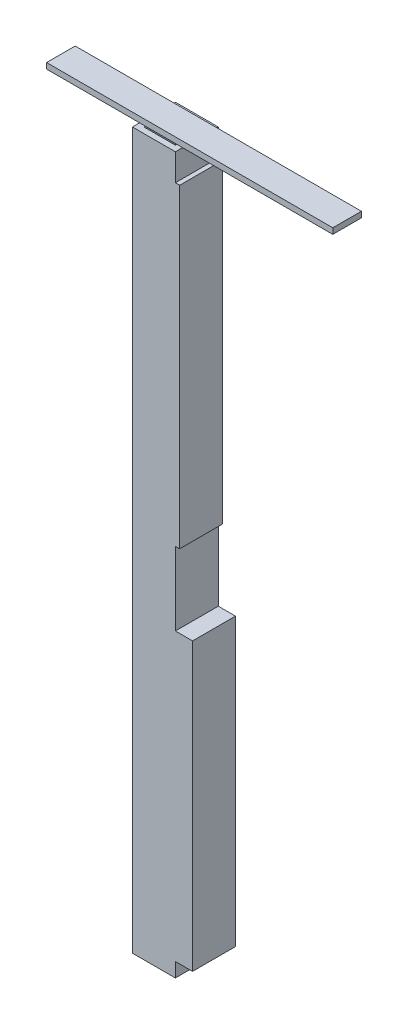
from build123d import *

# Parameters (mm, degrees)
SKETCH1_W          = 30
SKETCH1_H          = 30
EXTRUDE1_DEPTH     = 500
SKETCH2_W          = 22
SKETCH2_H          = 22
CUT_EXTRUDE1_DEPTH = 500
SKETCH3_W          = 200
SKETCH3_H          = 20
EXTRUDE2_DEPTH     = 4
SKETCH4_W          = 30
SKETCH4_H          = 200
EXTRUDE3_DEPTH     = 12
SKETCH6_W          = 30
SKETCH6_H          = 220
EXTRUDE4_DEPTH     = 3


with BuildPart() as part:
    # Sketch1 → Extrude1 (new body)
    with BuildSketch(Plane(origin=(0, 0, 0), x_dir=(1, 0, 0), z_dir=(0, 1, 0))):
        Rectangle(SKETCH1_W, SKETCH1_H)
    extrude(amount=EXTRUDE1_DEPTH)

    # Sketch2 → Cut-Extrude1 (cut)
    with BuildSketch(Plane(origin=(0, 500, 0), x_dir=(1, 0, 0), z_dir=(0, 1, 0))):
        Rectangle(SKETCH2_W, SKETCH2_H)
    extrude(amount=-CUT_EXTRUDE1_DEPTH, mode=Mode.SUBTRACT)

    # Sketch3 → Extrude2 (add)
    with BuildSketch(Plane(origin=(0, 500, 0), x_dir=(1, 0, 0), z_dir=(0, 1, 0))):
        with Locations((20, 0)):
            Rectangle(SKETCH3_W, SKETCH3_H)
    extrude(amount=EXTRUDE2_DEPTH)

    # Sketch4 → Extrude3 (add)
    with BuildSketch(Plane(origin=(15, 0, 0), x_dir=(0, 0, -1), z_dir=(1, 0, 0))):
        with Locations((0, 110)):
            Rectangle(SKETCH4_W, SKETCH4_H)
    extrude(amount=EXTRUDE3_DEPTH)

    # Sketch6 → Extrude4 (add)
    with BuildSketch(Plane(origin=(15, 0, 0), x_dir=(0, 0, -1), z_dir=(1, 0, 0))):
        with Locations((0, 371.238460257)):
            Rectangle(SKETCH6_W, SKETCH6_H)
    extrude(amount=EXTRUDE4_DEPTH)


solid = part.part
